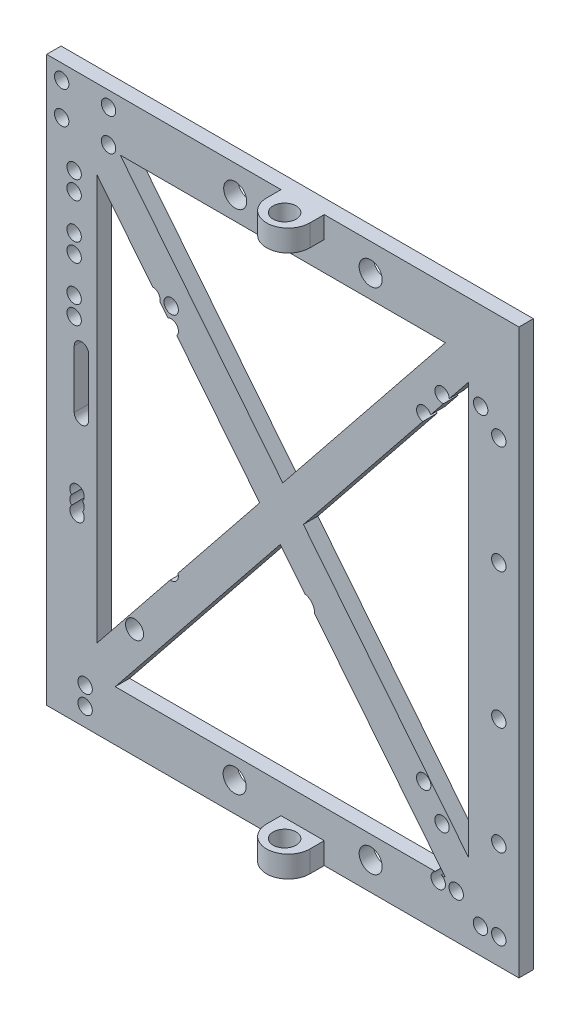
from build123d import *

# Parameters (mm, degrees)
SKETCH3_W            = 65.532
SKETCH3_H            = 78.232
SKETCH3_R            = 1
SKETCH3_R_2          = 1.25
SKETCH3_R_3          = 1.6
BOSS_EXTRUDE10_DEPTH = 2
SKETCH5_R            = 1.6
BOSS_EXTRUDE11_DEPTH = 3


with BuildPart() as part:
    # Sketch3 → Boss-Extrude10 (new body)
    with BuildSketch(Plane.XY):
        with Locations((-32.766, 39.116)):
            Rectangle(SKETCH3_W, SKETCH3_H)
        with Locations((-60.198, 2.535)):
            Circle(SKETCH3_R, mode=Mode.SUBTRACT)
        with Locations((-60.198, 5.075)):
            Circle(SKETCH3_R, mode=Mode.SUBTRACT)
        with Locations((-53.34, 15.24)):
            Circle(SKETCH3_R_2, mode=Mode.SUBTRACT)
        with Locations((-39.450944, 4.064)):
            Circle(SKETCH3_R_3, mode=Mode.SUBTRACT)
        with BuildLine():
            ThreePointArc((-60.547487864, 25.781), (-60.378588258, 25.483259443), (-60.32, 25.146))
            ThreePointArc((-60.32, 25.146), (-61.657259443, 24.204588258), (-62.092512136, 25.781))
            ThreePointArc((-62.092512136, 25.781), (-62.32, 26.416), (-62.092512136, 27.051))
            ThreePointArc((-62.092512136, 27.051), (-61.657259443, 28.627411742), (-60.32, 27.686))
            ThreePointArc((-60.32, 27.686), (-60.378588258, 27.348740557), (-60.547487864, 27.051))
            ThreePointArc((-60.547487864, 27.051), (-60.378588258, 26.753259443), (-60.32, 26.416))
            ThreePointArc((-60.32, 26.416), (-60.378588258, 26.078740557), (-60.547487864, 25.781))
        make_face(mode=Mode.SUBTRACT)
        with BuildLine():
            Line((-11.628420455, 7), (-56.019094707, 7))
            Line((-56.019094707, 7), (-33.112109743, 35.552384115))
            Line((-33.112109743, 35.552384115), (-29.697720228, 31.296522373))
            ThreePointArc((-29.697720228, 31.296522373), (-28.738744364, 30.752879791), (-28.359, 29.718))
            ThreePointArc((-28.359, 29.718), (-28.359594089, 29.67440261), (-28.361375915, 29.630837597))
            Line((-28.361375915, 29.630837597), (-10.205124779, 7))
            Line((-10.205124779, 7), (-10.773355545, 7))
            ThreePointArc((-10.773355545, 7), (-10.356041134, 6.631008199), (-10.200888, 6.096))
            ThreePointArc((-10.200888, 6.096), (-11.735896199, 5.251153134), (-11.628420455, 7))
        make_face(mode=Mode.SUBTRACT)
        with Locations((-20.574, 3.890944)):
            Circle(SKETCH3_R_3, mode=Mode.SUBTRACT)
        with Locations((-8.700888, 6.096)):
            Circle(SKETCH3_R, mode=Mode.SUBTRACT)
        with Locations((-5.339, 3.556)):
            Circle(SKETCH3_R, mode=Mode.SUBTRACT)
        with Locations((-2.799, 3.556)):
            Circle(SKETCH3_R, mode=Mode.SUBTRACT)
        with Locations((-10.668, 13.208)):
            Circle(SKETCH3_R, mode=Mode.SUBTRACT)
        with Locations((-13.213, 17.018)):
            Circle(SKETCH3_R, mode=Mode.SUBTRACT)
        with Locations((-2.794, 14.728)):
            Circle(SKETCH3_R, mode=Mode.SUBTRACT)
        with Locations((-2.794, 29.718)):
            Circle(SKETCH3_R, mode=Mode.SUBTRACT)
        with BuildLine():
            ThreePointArc((-61.706, 45.116), (-60.706, 46.116), (-59.706, 45.116))
            Line((-59.706, 45.116), (-59.706, 37.116))
            ThreePointArc((-59.706, 37.116), (-60.706, 36.116), (-61.706, 37.116))
            Line((-61.706, 37.116), (-61.706, 45.116))
        make_face(mode=Mode.SUBTRACT)
        with Locations((-61.722, 48.629)):
            Circle(SKETCH3_R, mode=Mode.SUBTRACT)
        with Locations((-61.722, 51.169)):
            Circle(SKETCH3_R, mode=Mode.SUBTRACT)
        with Locations((-61.722, 56.129)):
            Circle(SKETCH3_R, mode=Mode.SUBTRACT)
        with Locations((-61.722, 58.669)):
            Circle(SKETCH3_R, mode=Mode.SUBTRACT)
        with BuildLine():
            Line((-58.532, 10.995023961), (-58.532, 67.236976039))
            Line((-58.532, 67.236976039), (-50.821827001, 57.626640091))
            ThreePointArc((-50.821827001, 57.626640091), (-50.014999166, 57.252778474), (-49.824952048, 56.384086494))
            Line((-49.824952048, 56.384086494), (-48.700366603, 54.982348306))
            ThreePointArc((-48.700366603, 54.982348306), (-47.474999166, 54.712778474), (-47.477503777, 53.458112393))
            Line((-47.477503777, 53.458112393), (-35.971124779, 39.116))
            Line((-35.971124779, 39.116), (-47.320258494, 24.969885803))
            ThreePointArc((-47.320258494, 24.969885803), (-47.275179837, 24.801577784), (-47.26, 24.628))
            ThreePointArc((-47.26, 24.628), (-47.600460693, 23.876329925), (-48.390015804, 23.636488078))
            Line((-48.390015804, 23.636488078), (-58.532, 10.995023961))
        make_face(mode=Mode.SUBTRACT)
        with Locations((-48.255, 56.627)):
            Circle(SKETCH3_R, mode=Mode.SUBTRACT)
        Polygon((-32.766, 43.111023961), (-55.326875221, 71.232), (-10.205124779, 71.232), align=None, mode=Mode.SUBTRACT)
        with Locations((-61.722, 63.629)):
            Circle(SKETCH3_R, mode=Mode.SUBTRACT)
        with Locations((-61.722, 66.169)):
            Circle(SKETCH3_R, mode=Mode.SUBTRACT)
        with Locations((-63.448, 71.664)):
            Circle(SKETCH3_R, mode=Mode.SUBTRACT)
        with Locations((-63.448, 76.164)):
            Circle(SKETCH3_R, mode=Mode.SUBTRACT)
        with Locations((-56.948, 71.664)):
            Circle(SKETCH3_R, mode=Mode.SUBTRACT)
        with Locations((-56.948, 76.164)):
            Circle(SKETCH3_R, mode=Mode.SUBTRACT)
        with Locations((-39.37, 74.422)):
            Circle(SKETCH3_R_3, mode=Mode.SUBTRACT)
        with BuildLine():
            Line((-9.668009055, 64.774255485), (-7, 68.099792192))
            Line((-7, 68.099792192), (-7, 10.995023961))
            Line((-7, 10.995023961), (-29.906984964, 39.547408077))
            Line((-29.906984964, 39.547408077), (-13.321002101, 60.220986655))
            ThreePointArc((-13.321002101, 60.220986655), (-13.983000834, 61.839778474), (-12.259188179, 61.544483353))
            Line((-12.259188179, 61.544483353), (-10.455353631, 63.792870775))
            ThreePointArc((-10.455353631, 63.792870775), (-11.448000834, 65.395778474), (-9.668009055, 64.774255485))
        make_face(mode=Mode.SUBTRACT)
        with Locations((-2.794, 48.514)):
            Circle(SKETCH3_R, mode=Mode.SUBTRACT)
        with Locations((-20.574, 74.422)):
            Circle(SKETCH3_R_3, mode=Mode.SUBTRACT)
        with Locations((-2.794, 63.504)):
            Circle(SKETCH3_R, mode=Mode.SUBTRACT)
        with Locations((-5.309112, 66.04)):
            Circle(SKETCH3_R, mode=Mode.SUBTRACT)
    extrude(amount=BOSS_EXTRUDE10_DEPTH)

    # Sketch5 → Boss-Extrude11 (add)
    with BuildSketch(Plane.XZ):
        with BuildLine():
            Line((-33.014, 2), (-27.014, 2))
            Line((-27.014, 2), (-27.014, 4))
            ThreePointArc((-27.014, 4), (-30.014, 7), (-33.014, 4))
            Line((-33.014, 4), (-33.014, 2))
        make_face()
        with Locations(Location((-30.014, 4.5, 0), (0, 0, 270))):
            Circle(SKETCH5_R, mode=Mode.SUBTRACT)
    boss_extrude11 = extrude(amount=-BOSS_EXTRUDE11_DEPTH)

    # Mirror1: Boss-Extrude11 across plane
    add(boss_extrude11.mirror(Plane.ZX.offset(39.116)))


solid = part.part
